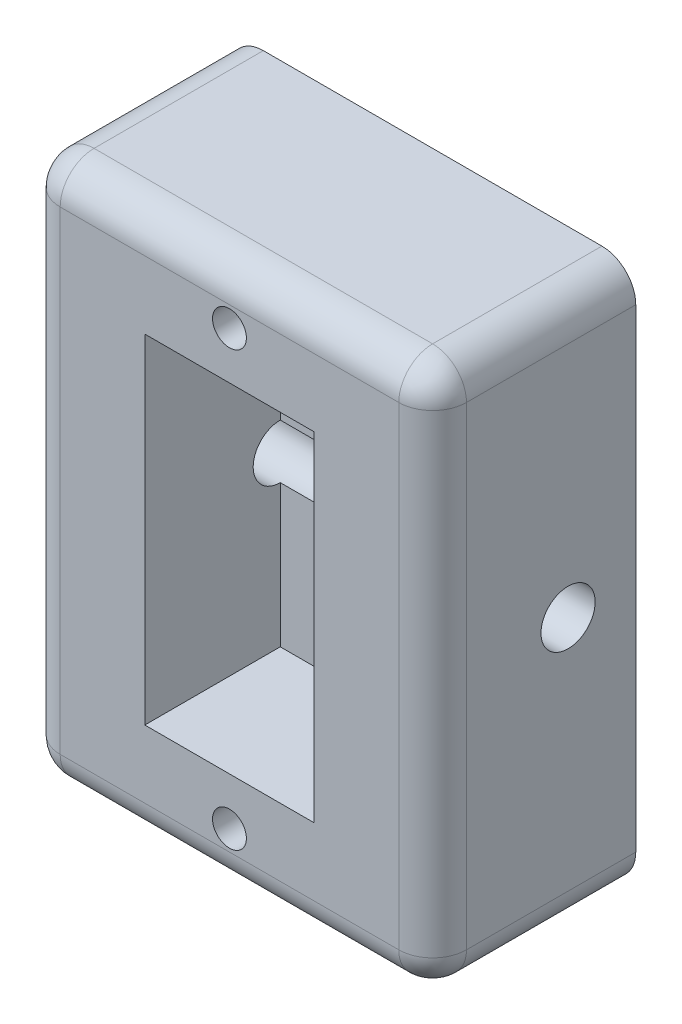
from build123d import *

# Parameters (mm, degrees)
SKETCH1_W               = 60
SKETCH1_H               = 80
BOSS_EXTRUDE1_DEPTH     = 30
SKETCH2_W               = 25
SKETCH2_H               = 50
CUT_EXTRUDE1_DEPTH      = 20
CUT_EXTRUDE3_DEPTH      = 59.309518948
CUT_EXTRUDE3_DEPTH_BACK = 59.309518948
SKETCH4_R               = 4
CUT_EXTRUDE4_DEPTH      = 59.309518948
CUT_EXTRUDE4_DEPTH_BACK = 29
SKETCH5_R               = 2.5
FILLET1_R               = 5


with BuildPart() as part:
    # Sketch1 → Boss-Extrude1 (new body)
    with BuildSketch(Plane.XY):
        Rectangle(SKETCH1_W, SKETCH1_H)
    extrude(amount=-BOSS_EXTRUDE1_DEPTH)

    # Sketch2 → Cut-Extrude1 (cut)
    with BuildSketch(Plane.XY):
        Rectangle(SKETCH2_W, SKETCH2_H)
    extrude(amount=-CUT_EXTRUDE1_DEPTH, mode=Mode.SUBTRACT)

    # Sketch4 → Cut-Extrude3 (cut, two sides: drawn at the far end of the back side and taken through both)
    with BuildSketch(Plane(origin=(0, 0, 0), x_dir=(0, 0, -1), z_dir=(1, 0, 0)).offset(-CUT_EXTRUDE3_DEPTH_BACK)):
        with Locations((20, 0)):
            Circle(SKETCH4_R)
    extrude(amount=CUT_EXTRUDE3_DEPTH + CUT_EXTRUDE3_DEPTH_BACK, mode=Mode.SUBTRACT)

    # Sketch5 → Cut-Extrude4 (cut, two sides: drawn at the far end of the back side and taken through both)
    with BuildSketch(Plane.XY.offset(-CUT_EXTRUDE4_DEPTH_BACK)):
        with Locations(Location((0, 32, 0), (0, 0, 180))):
            Circle(SKETCH5_R)
        with Locations(Location((0, -32, 0), (0, 0, 180))):
            Circle(SKETCH5_R)
    extrude(amount=CUT_EXTRUDE4_DEPTH + CUT_EXTRUDE4_DEPTH_BACK, mode=Mode.SUBTRACT)

    # Fillet1
    fillet1_edges = [part.edges().sort_by_distance(p)[0] for p in [
        (0, -40, 0),
        (-30, 0, 0),
        (0, 40, 0),
        (30, 0, 0),
        (30, -40, -15),
        (-30, -40, -15),
        (-30, 40, -15),
        (30, 40, -15),
    ]]
    fillet(fillet1_edges, radius=FILLET1_R)


solid = part.part
